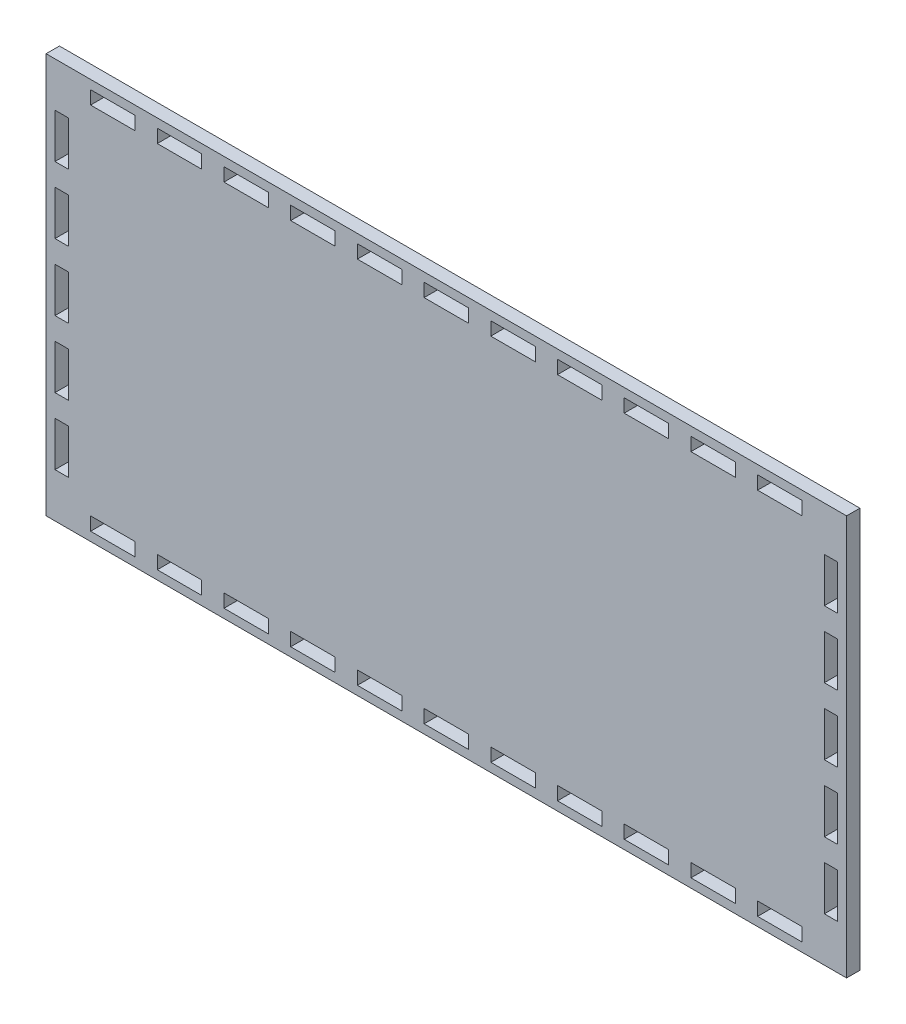
from build123d import *

# Parameters (mm, degrees)
SKETCH_1_W      = 180
SKETCH_1_H      = 90
SKETCH_1_W_2    = 10
SKETCH_1_H_2    = 3
SKETCH_1_W_3    = 3
SKETCH_1_H_3    = 10
EXTRUDE_1_DEPTH = 3


with BuildPart() as part:
    # 草图1 → 凸台-拉伸1 (new body)
    with BuildSketch(Plane.XY):
        with Locations((-0.098158541, -0.288232222)):
            Rectangle(SKETCH_1_W, SKETCH_1_H)
        with Locations((-75.098158541, 41.211767778)):
            Rectangle(SKETCH_1_W_2, SKETCH_1_H_2, mode=Mode.SUBTRACT)
        with Locations((-86.598158541, 29.711767778)):
            Rectangle(SKETCH_1_W_3, SKETCH_1_H_3, mode=Mode.SUBTRACT)
        with Locations((-86.598158541, 14.711767778)):
            Rectangle(SKETCH_1_W_3, SKETCH_1_H_3, mode=Mode.SUBTRACT)
        with Locations((-86.598158541, -0.288232222)):
            Rectangle(SKETCH_1_W_3, SKETCH_1_H_3, mode=Mode.SUBTRACT)
        with Locations((-86.598158541, -15.288232222)):
            Rectangle(SKETCH_1_W_3, SKETCH_1_H_3, mode=Mode.SUBTRACT)
        with Locations((-86.598158541, -30.288232222)):
            Rectangle(SKETCH_1_W_3, SKETCH_1_H_3, mode=Mode.SUBTRACT)
        with Locations((86.401841459, -30.288232222)):
            Rectangle(SKETCH_1_W_3, SKETCH_1_H_3, mode=Mode.SUBTRACT)
        with Locations((86.401841459, -15.288232222)):
            Rectangle(SKETCH_1_W_3, SKETCH_1_H_3, mode=Mode.SUBTRACT)
        with Locations((86.401841459, -0.288232222)):
            Rectangle(SKETCH_1_W_3, SKETCH_1_H_3, mode=Mode.SUBTRACT)
        with Locations((86.401841459, 14.711767778)):
            Rectangle(SKETCH_1_W_3, SKETCH_1_H_3, mode=Mode.SUBTRACT)
        with Locations((86.401841459, 29.711767778)):
            Rectangle(SKETCH_1_W_3, SKETCH_1_H_3, mode=Mode.SUBTRACT)
        with Locations((-60.098158541, 41.211767778)):
            Rectangle(SKETCH_1_W_2, SKETCH_1_H_2, mode=Mode.SUBTRACT)
        with Locations((-45.098158541, 41.211767778)):
            Rectangle(SKETCH_1_W_2, SKETCH_1_H_2, mode=Mode.SUBTRACT)
        with Locations((-30.098158541, 41.211767778)):
            Rectangle(SKETCH_1_W_2, SKETCH_1_H_2, mode=Mode.SUBTRACT)
        with Locations((-15.098158541, 41.211767778)):
            Rectangle(SKETCH_1_W_2, SKETCH_1_H_2, mode=Mode.SUBTRACT)
        with Locations((-0.098158541, 41.211767778)):
            Rectangle(SKETCH_1_W_2, SKETCH_1_H_2, mode=Mode.SUBTRACT)
        with Locations((14.901841459, 41.211767778)):
            Rectangle(SKETCH_1_W_2, SKETCH_1_H_2, mode=Mode.SUBTRACT)
        with Locations((29.901841459, 41.211767778)):
            Rectangle(SKETCH_1_W_2, SKETCH_1_H_2, mode=Mode.SUBTRACT)
        with Locations((44.901841459, 41.211767778)):
            Rectangle(SKETCH_1_W_2, SKETCH_1_H_2, mode=Mode.SUBTRACT)
        with Locations((59.901841459, 41.211767778)):
            Rectangle(SKETCH_1_W_2, SKETCH_1_H_2, mode=Mode.SUBTRACT)
        with Locations((74.901841459, 41.211767778)):
            Rectangle(SKETCH_1_W_2, SKETCH_1_H_2, mode=Mode.SUBTRACT)
        with Locations((74.901841459, -41.788232222)):
            Rectangle(SKETCH_1_W_2, SKETCH_1_H_2, mode=Mode.SUBTRACT)
        with Locations((59.901841459, -41.788232222)):
            Rectangle(SKETCH_1_W_2, SKETCH_1_H_2, mode=Mode.SUBTRACT)
        with Locations((44.901841459, -41.788232222)):
            Rectangle(SKETCH_1_W_2, SKETCH_1_H_2, mode=Mode.SUBTRACT)
        with Locations((29.901841459, -41.788232222)):
            Rectangle(SKETCH_1_W_2, SKETCH_1_H_2, mode=Mode.SUBTRACT)
        with Locations((14.901841459, -41.788232222)):
            Rectangle(SKETCH_1_W_2, SKETCH_1_H_2, mode=Mode.SUBTRACT)
        with Locations((-0.098158541, -41.788232222)):
            Rectangle(SKETCH_1_W_2, SKETCH_1_H_2, mode=Mode.SUBTRACT)
        with Locations((-15.098158541, -41.788232222)):
            Rectangle(SKETCH_1_W_2, SKETCH_1_H_2, mode=Mode.SUBTRACT)
        with Locations((-30.098158541, -41.788232222)):
            Rectangle(SKETCH_1_W_2, SKETCH_1_H_2, mode=Mode.SUBTRACT)
        with Locations((-45.098158541, -41.788232222)):
            Rectangle(SKETCH_1_W_2, SKETCH_1_H_2, mode=Mode.SUBTRACT)
        with Locations((-60.098158541, -41.788232222)):
            Rectangle(SKETCH_1_W_2, SKETCH_1_H_2, mode=Mode.SUBTRACT)
        with Locations((-75.098158541, -41.788232222)):
            Rectangle(SKETCH_1_W_2, SKETCH_1_H_2, mode=Mode.SUBTRACT)
    extrude(amount=EXTRUDE_1_DEPTH)


solid = part.part
